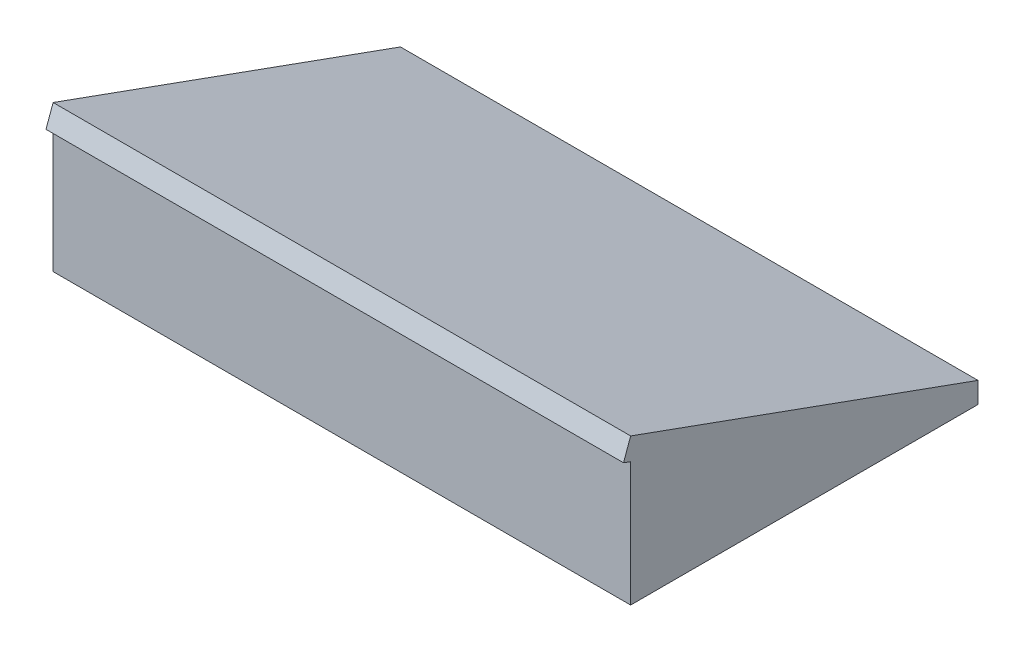
from build123d import *

# Parameters (mm, degrees)
SKETCH1_W           = 138
SKETCH1_H           = 83
BOSS_EXTRUDE1_DEPTH = 5
BOSS_EXTRUDE2_DEPTH = 5
BOSS_EXTRUDE3_DEPTH = 5
SKETCH5_W           = 128
SKETCH5_H           = 25
BOSS_EXTRUDE4_DEPTH = 5
SKETCH7_W           = 138
SKETCH7_H           = 88.255311455
BOSS_EXTRUDE7_DEPTH = 5


with BuildPart() as part:
    # Sketch1 → Boss-Extrude1 (new body)
    with BuildSketch(Plane(origin=(0, 0, 0), x_dir=(1, 0, 0), z_dir=(0, 1, 0))):
        Rectangle(SKETCH1_W, SKETCH1_H)
    extrude(amount=BOSS_EXTRUDE1_DEPTH)

    # Sketch4 → Boss-Extrude3 (add)
    with BuildSketch(Plane.ZY.offset(69)):
        Polygon((41.5, 5), (41.5, 35), (-41.5, 5), align=None)
    extrude(amount=-BOSS_EXTRUDE3_DEPTH)



with BuildPart() as body_2:
    # Sketch2 → Boss-Extrude2 (new body)
    with BuildSketch(Plane(origin=(69, 0, 0), x_dir=(0, 0, -1), z_dir=(1, 0, 0))):
        Polygon((-41.5, 5), (-41.5, 35), (41.5, 5), align=None)
    extrude(amount=-BOSS_EXTRUDE2_DEPTH)


with BuildPart() as part_1:
    add(part.part)

    add(body_2.part)  # Boss-Extrude4 merges body 2
    # Sketch5 → Boss-Extrude4 (add)
    with BuildSketch(Plane.XY.offset(41.5)):
        with Locations((0, 17.5)):
            Rectangle(SKETCH5_W, SKETCH5_H)
    extrude(amount=-BOSS_EXTRUDE4_DEPTH)

    # Sketch7 → Boss-Extrude7 (add)
    with BuildSketch(Plane(origin=(0, 17.689048658, -6.393632045), x_dir=(1, 0, 0), z_dir=(0, 0.9404533124606549, -0.33992288402192333))):
        with Locations((0, -6.798457681)):
            Rectangle(SKETCH7_W, SKETCH7_H)
    extrude(amount=-BOSS_EXTRUDE7_DEPTH)


solid = part_1.part
